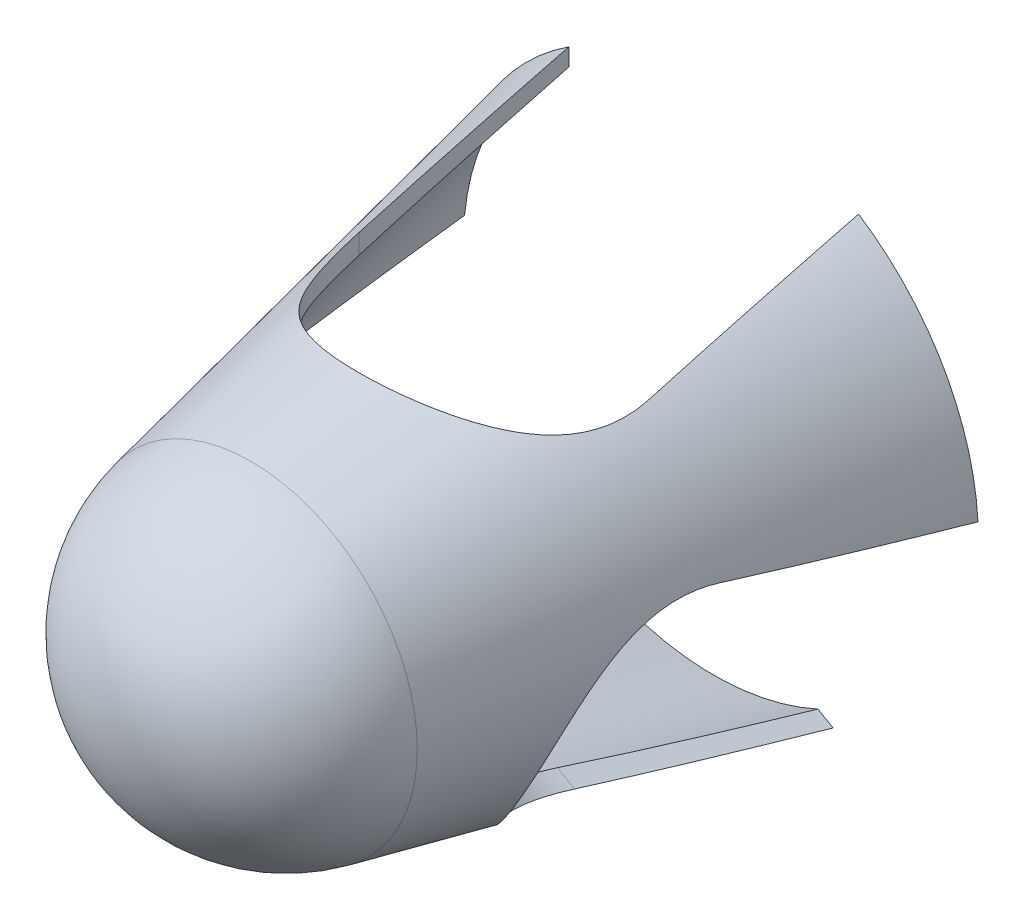
from build123d import *

# Parameters (mm, degrees)
SCHNITT_LINEAR_AUSTRAGEN1_DEPTH = 7437.463671953
KREISMUSTER1_COUNT              = 3


with BuildPart() as part:
    # Skizze1 → Rotation1 (revolve)
    with BuildSketch(Plane(origin=(0, 0, 0), x_dir=(0, 0, -1), z_dir=(1, 0, 0)), mode=Mode.PRIVATE) as rotation1_sk:
        with BuildLine():
            Line((2900, -3654.083713853), (-3488.083971691, -2296.254549171))
            ThreePointArc((-3488.083971691, -2296.254549171), (-4824.392298286, -1477.363753436), (-5347.554241761, 0))
            Line((-5347.554241761, 0), (-3000, 0))
            Line((-3000, 0), (-3000, -2200))
            Line((-3000, -2200), (2900, -3454.083713853))
            Line((2900, -3454.083713853), (2900, -3654.083713853))
        make_face()
    revolve(rotation1_sk.sketch.rotate(Axis((0, 0, 0), (0, 0, -1)), 270), axis=Axis((0, 0, 0), (0, 0, -1)))

    # Skizze2 → Schnitt-Linear austragen1 (cut, through all)
    with BuildSketch(Plane(origin=(0, 0, 0), x_dir=(1, 0, 0), z_dir=(0, 1, 0))):
        with BuildLine():
            Line((-2000, 0), (-2000, 2900))
            Line((-2000, 2900), (2000, 2900))
            Line((2000, 2900), (2000, 0))
            ThreePointArc((2000, 0), (0, -2000), (-2000, 0))
        make_face()
    schnitt_linear_austragen1 = extrude(amount=SCHNITT_LINEAR_AUSTRAGEN1_DEPTH, mode=Mode.SUBTRACT)

    # Kreismuster1: Schnitt-Linear austragen1 ×3 about axis
    kreismuster1_axis = Axis((0, 0, 0), (0, 0, 1))
    for i in range(1, KREISMUSTER1_COUNT):
        add(schnitt_linear_austragen1.rotate(kreismuster1_axis, i * 360 / KREISMUSTER1_COUNT), mode=Mode.SUBTRACT)


solid = part.part
